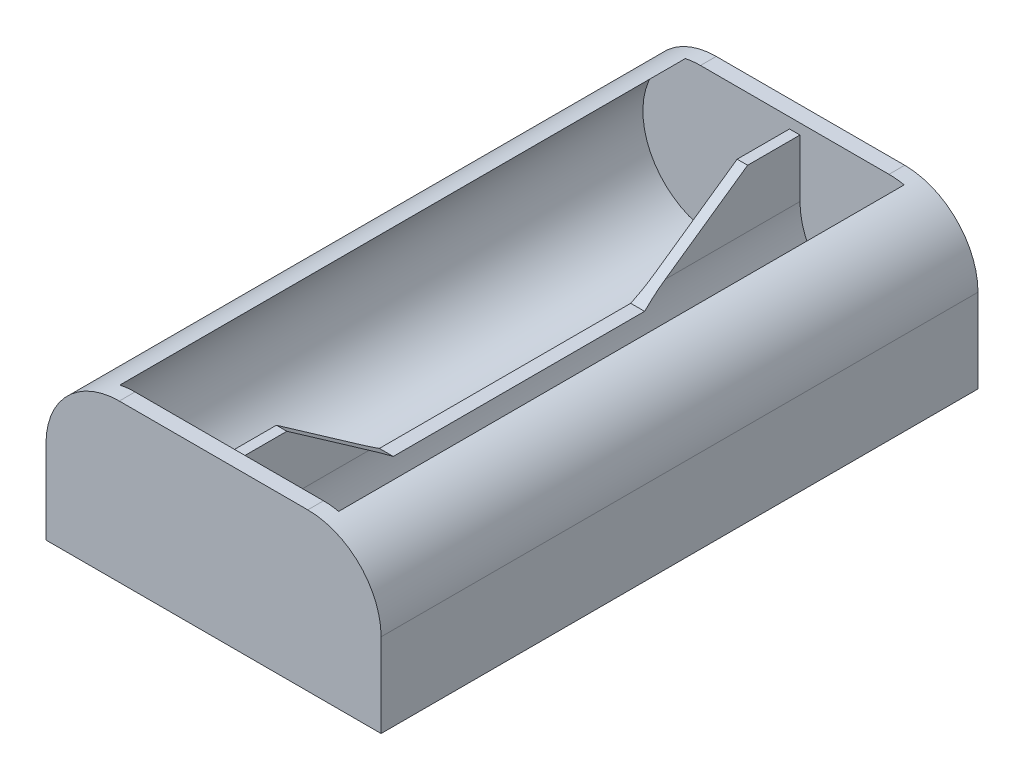
from build123d import *

# Parameters (mm, degrees)
SKETCH1_W           = 47
SKETCH1_H           = 55.5
BOSS_EXTRUDE1_DEPTH = 15
CUT_EXTRUDE4_DEPTH  = 54
FILLET1_R           = 7
FILLET2_R           = 7
SKETCH3_W           = 4.401923789
SKETCH3_H           = 6.5
CUT_EXTRUDE5_DEPTH  = 54
SKETCH4_W           = 1
SKETCH4_H           = 1
CUT_EXTRUDE6_DEPTH  = 54
CUT_EXTRUDE7_DEPTH  = 20
CUT_EXTRUDE8_DEPTH  = 5
BOSS_EXTRUDE3_DEPTH = 1.5
CUT_EXTRUDE9_DEPTH  = 57


with BuildPart() as part:
    # Sketch1 → Boss-Extrude1 (new body)
    with BuildSketch(Plane(origin=(0, 0, 0), x_dir=(1, 0, 0), z_dir=(0, 1, 0))):
        with Locations((23.5, -27.75)):
            Rectangle(SKETCH1_W, SKETCH1_H)
    extrude(amount=BOSS_EXTRUDE1_DEPTH)

    # Sketch2 → Cut-Extrude4 (cut)
    with BuildSketch(Plane.XY.offset(55.5)):
        with BuildLine():
            Line((11.098076211, 15), (5.901923789, 15))
            ThreePointArc((5.901923789, 15), (8.5, 1.5), (11.098076211, 15))
        make_face()
        with BuildLine():
            Line((26.098076211, 15), (20.901923789, 15))
            ThreePointArc((20.901923789, 15), (23.5, 1.5), (26.098076211, 15))
        make_face()
        with BuildLine():
            ThreePointArc((35.901923789, 15), (38.5, 1.5), (41.098076211, 15))
            Line((41.098076211, 15), (35.901923789, 15))
        make_face()
    extrude(amount=-CUT_EXTRUDE4_DEPTH, mode=Mode.SUBTRACT)

    # Fillet1
    fillet1_edges = [part.edges().sort_by_distance(p)[0] for p in [
        (47, 15, 27.75),
    ]]
    fillet(fillet1_edges, radius=FILLET1_R)

    # Fillet2
    fillet2_edges = [part.edges().sort_by_distance(p)[0] for p in [
        (0, 15, 27.75),
    ]]
    fillet(fillet2_edges, radius=FILLET2_R)

    # Sketch3 → Cut-Extrude5 (cut)
    with BuildSketch(Plane.XY.offset(55.5)):
        with Locations((28.299038106, 11.75)):
            Rectangle(SKETCH3_W, SKETCH3_H)
        with Locations((33.700961895, 11.75)):
            Rectangle(SKETCH3_W, SKETCH3_H)
        with Locations((13.299038106, 11.75)):
            Rectangle(SKETCH3_W, SKETCH3_H)
        with Locations((18.700961895, 11.75)):
            Rectangle(SKETCH3_W, SKETCH3_H)
    extrude(amount=-CUT_EXTRUDE5_DEPTH, mode=Mode.SUBTRACT)

    # Sketch4 → Cut-Extrude6 (cut)
    with BuildSketch(Plane.XY.offset(55.5)):
        with Locations((16, 14.5)):
            Rectangle(SKETCH4_W, SKETCH4_H)
        with Locations((31, 14.5)):
            Rectangle(SKETCH4_W, SKETCH4_H)
    extrude(amount=-CUT_EXTRUDE6_DEPTH, mode=Mode.SUBTRACT)

    # Sketch5 → Cut-Extrude7 (cut)
    with BuildSketch(Plane.ZY.offset(-15.5)):
        Polygon((6.5, 14), (50.5, 14), (40.5, 7), (16.5, 7), align=None)
    extrude(amount=-CUT_EXTRUDE7_DEPTH, mode=Mode.SUBTRACT)

    # Sketch5<2> → Cut-Extrude8 (cut)
    with BuildSketch(Plane.ZY.offset(-15.5)):
        Polygon((6.5, 14), (50.5, 14), (40.5, 7), (16.5, 7), align=None)
    extrude(amount=CUT_EXTRUDE8_DEPTH, mode=Mode.SUBTRACT)

    # Sketch6 → Boss-Extrude3 (add)
    with BuildSketch(Plane.XY.offset(55.5)):
        with BuildLine():
            Line((0, 0), (47, 0))
            Line((47, 0), (47, 8))
            ThreePointArc((47, 8), (44.949747468, 12.949747468), (40, 15))
            Line((40, 15), (7, 15))
            ThreePointArc((7, 15), (2.050252532, 12.949747468), (0, 8))
            Line((0, 8), (0, 0))
        make_face()
    extrude(amount=BOSS_EXTRUDE3_DEPTH)

    # Sketch7 → Cut-Extrude9 (cut)
    with BuildSketch(Plane.XY.offset(57)):
        Polygon((16, 8), (16, 15), (47, 15), (47, 0), (16, 0), align=None)
    extrude(amount=-CUT_EXTRUDE9_DEPTH, mode=Mode.SUBTRACT)

    # Mirror1: part across plane


with BuildPart() as part_1:
    add(part.part)
    add(part.part.mirror(Plane(origin=(16, 8, 0), x_dir=(0, 0, 1), z_dir=(-1, 0, 0))))


solid = part_1.part
